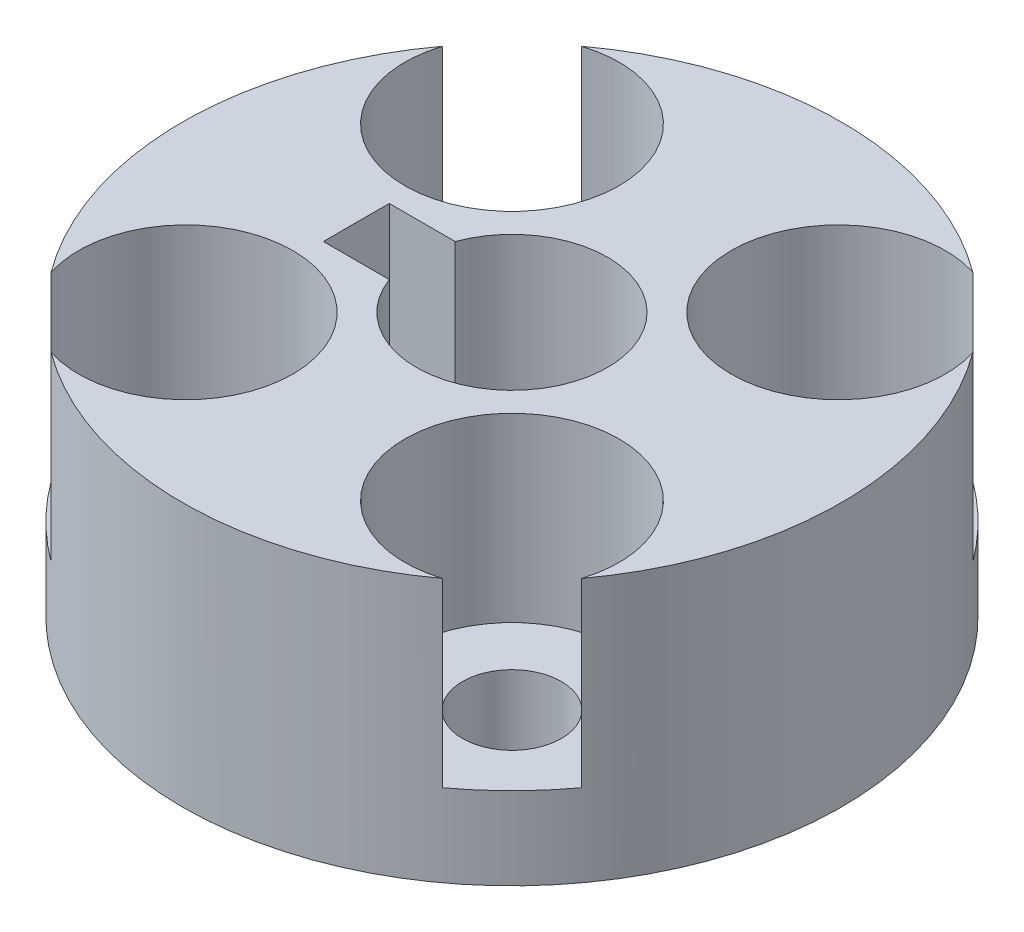
from build123d import *

# Parameters (mm, degrees)
SKETCH1_R           = 10
SKETCH1_R_2         = 1.5
BOSS_EXTRUDE1_DEPTH = 2.5
BOSS_EXTRUDE5_DEPTH = 8


with BuildPart() as part:
    # Sketch1 → Boss-Extrude1 (new body)
    with BuildSketch(Plane(origin=(0, 0, 0), x_dir=(1, 0, 0), z_dir=(0, 1, 0))):
        Circle(SKETCH1_R)
        with Locations((4.949747468, 4.949747468)):
            Circle(SKETCH1_R_2, mode=Mode.SUBTRACT)
        with BuildLine():
            Line((-4.722131518, 1), (-2.722131518, 1))
            ThreePointArc((-2.722131518, 1), (2.9, 0), (-2.722131518, -1))
            Line((-2.722131518, -1), (-4.722131518, -1))
            Line((-4.722131518, -1), (-4.722131518, 1))
        make_face(mode=Mode.SUBTRACT)
        with Locations((4.949747468, -4.949747468)):
            Circle(SKETCH1_R_2, mode=Mode.SUBTRACT)
        with Locations((-4.949747468, -4.949747468)):
            Circle(SKETCH1_R_2, mode=Mode.SUBTRACT)
        with Locations((-4.949747468, 4.949747468)):
            Circle(SKETCH1_R_2, mode=Mode.SUBTRACT)
    extrude(amount=BOSS_EXTRUDE1_DEPTH)

    # Sketch1<14> → Boss-Extrude5 (add)
    with BuildSketch(Plane(origin=(0, 0, 0), x_dir=(1, 0, 0), z_dir=(0, 1, 0))):
        with BuildLine():
            ThreePointArc((8.045640675, -5.938658614), (10, 0), (8.045640675, 5.938658614))
            ThreePointArc((8.045640675, 5.938658614), (2.651650429, 2.651650429), (5.938658614, 8.045640675))
            ThreePointArc((5.938658614, 8.045640675), (0, 10), (-5.938658614, 8.045640675))
            ThreePointArc((-5.938658614, 8.045640675), (-2.651650429, 2.651650429), (-8.045640675, 5.938658614))
            ThreePointArc((-8.045640675, 5.938658614), (-10, 0), (-8.045640675, -5.938658614))
            ThreePointArc((-8.045640675, -5.938658614), (-2.651650429, -2.651650429), (-5.938658614, -8.045640675))
            ThreePointArc((-5.938658614, -8.045640675), (0, -10), (5.938658614, -8.045640675))
            ThreePointArc((5.938658614, -8.045640675), (2.651650429, -2.651650429), (8.045640675, -5.938658614))
        make_face()
        with BuildLine():
            Line((-4.722131518, -1), (-4.722131518, 1))
            Line((-4.722131518, 1), (-2.722131518, 1))
            ThreePointArc((-2.722131518, 1), (2.9, 0), (-2.722131518, -1))
            Line((-2.722131518, -1), (-4.722131518, -1))
        make_face(mode=Mode.SUBTRACT)
    extrude(amount=BOSS_EXTRUDE5_DEPTH)


solid = part.part
